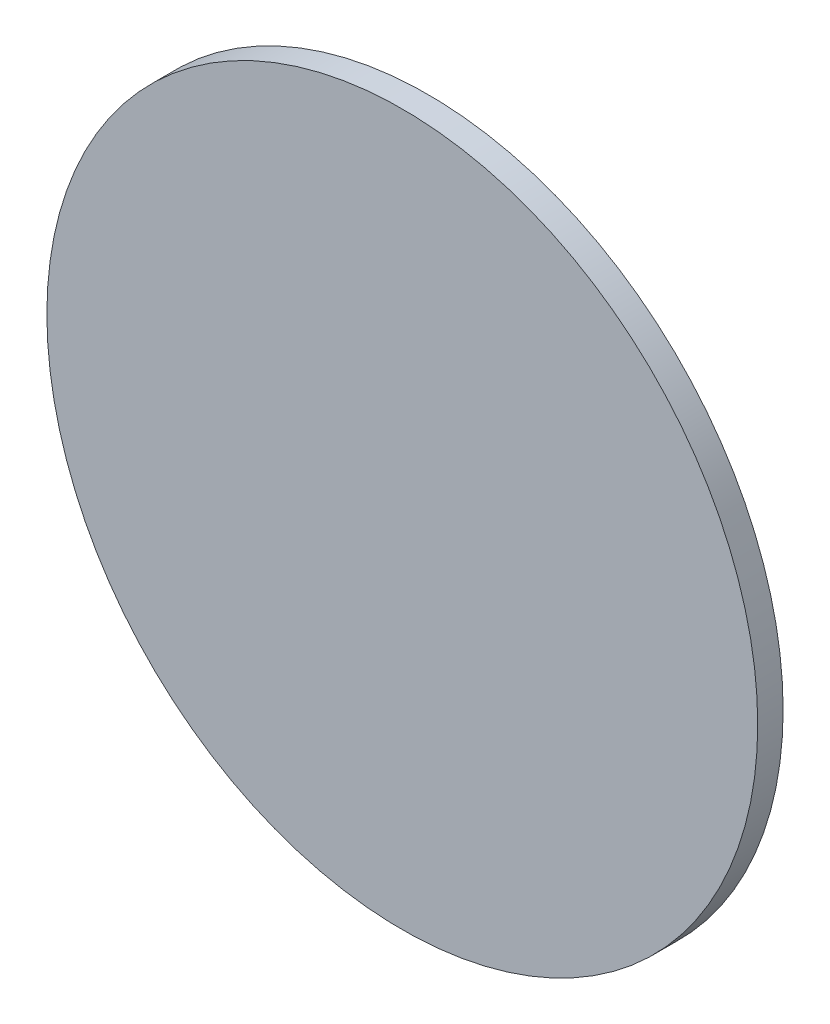
from build123d import *

# Parameters (mm, degrees)
SKETCH1_R           = 140
BOSS_EXTRUDE1_DEPTH = 10


with BuildPart() as part:
    # Sketch1 → Boss-Extrude1 (new body)
    with BuildSketch(Plane.XY):
        Circle(SKETCH1_R)
    extrude(amount=BOSS_EXTRUDE1_DEPTH)


solid = part.part
